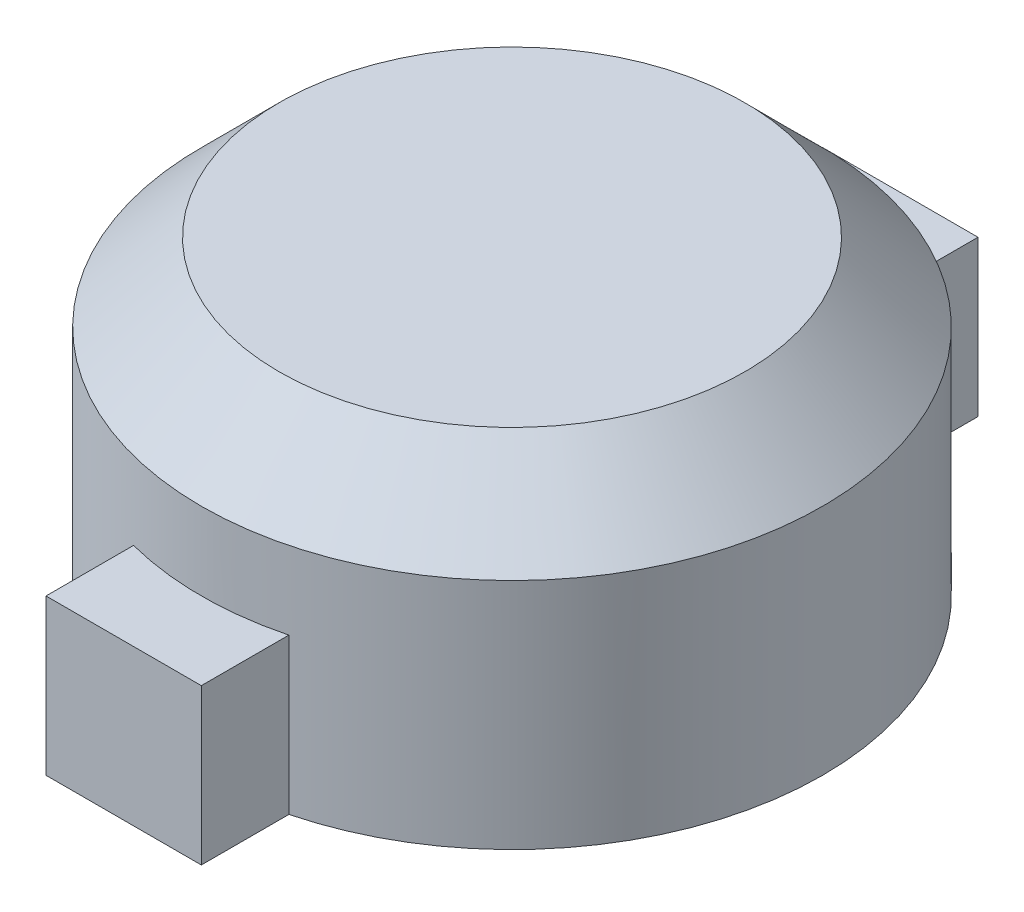
from build123d import *

# Parameters (mm, degrees)
SKETCH1_R           = 4
BOSS_EXTRUDE1_DEPTH = 4
SKETCH2_W           = 2
SKETCH2_H           = 10
BOSS_EXTRUDE2_DEPTH = 2
CHAMFER1_SIZE       = 1


with BuildPart() as part:
    # Sketch1 → Boss-Extrude1 (new body)
    with BuildSketch(Plane(origin=(0, 0, 0), x_dir=(1, 0, 0), z_dir=(0, 1, 0))):
        with Locations(Location((0, 0, 0), (0, 0, 270))):
            Circle(SKETCH1_R)
    extrude(amount=BOSS_EXTRUDE1_DEPTH)

    # Sketch2 → Boss-Extrude2 (add)
    with BuildSketch(Plane.XZ):
        Rectangle(SKETCH2_W, SKETCH2_H)
    extrude(amount=-BOSS_EXTRUDE2_DEPTH)

    # Chamfer1
    chamfer1_edges = [part.edges().sort_by_distance(p)[0] for p in [
        (0, 4, -4),
    ]]
    chamfer(chamfer1_edges, length=CHAMFER1_SIZE)


solid = part.part
